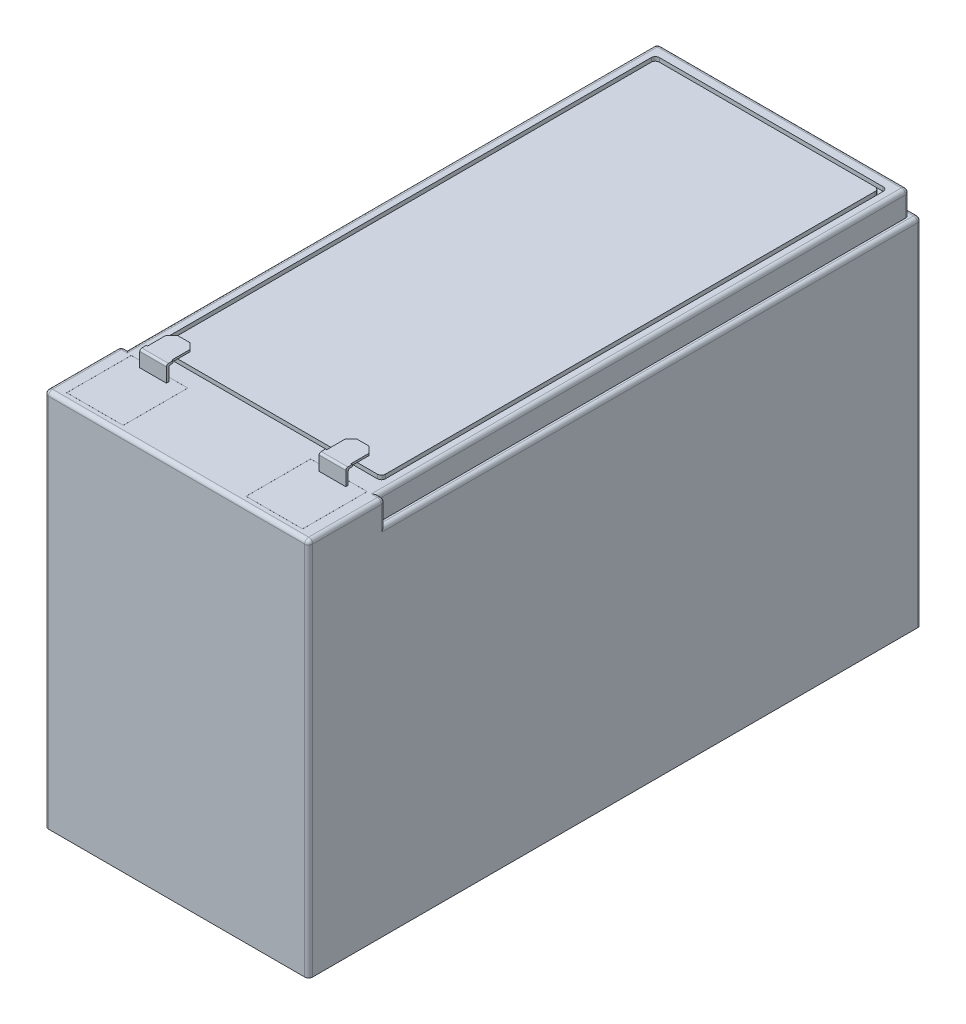
from build123d import *

# Parameters (mm, degrees)
CROQUIS1_W              = 65.4
CROQUIS1_H              = 151.7
SALIENTE_EXTRUIR1_DEPTH = 93.8
CORTAR_EXTRUIR1_DEPTH   = 6
REDONDEO1_R             = 1
CORTAR_EXTRUIR2_DEPTH   = 1
CROQUIS4_W              = 14
CROQUIS4_H              = 16
CROQUIS4_W_2            = 13.98
CROQUIS4_H_2            = 15.98
CORTAR_EXTRUIR3_DEPTH   = 1
CROQUIS5_W              = 6.6
CROQUIS5_H              = 0.6
SALIENTE_EXTRUIR2_DEPTH = 4
CROQUIS6_W              = 6.6
CROQUIS6_H              = 0.5
SALIENTE_EXTRUIR3_DEPTH = 1
CROQUIS7_W              = 6
CROQUIS7_H              = 0.5
SALIENTE_EXTRUIR4_DEPTH = 6
REDONDEO2_R             = 0.5
CHAFL_N1_SIZE           = 1.5


with BuildPart() as part:
    # Croquis1 → Saliente-Extruir1 (new body)
    with BuildSketch(Plane(origin=(0, 0, 0), x_dir=(1, 0, 0), z_dir=(0, 1, 0))):
        Rectangle(CROQUIS1_W, CROQUIS1_H)
    extrude(amount=SALIENTE_EXTRUIR1_DEPTH)

    # Croquis2 → Cortar-Extruir1 (cut)
    with BuildSketch(Plane(origin=(0, 93.8, 0), x_dir=(1, 0, 0), z_dir=(0, 1, 0))):
        Polygon((-32.7, -56.85), (-32.7, 75.85), (32.7, 75.85), (32.7, -56.85), (31.2, -56.85), (31.2, 74.35), (-31.2, 74.35), (-31.2, -56.85), align=None)
    extrude(amount=-CORTAR_EXTRUIR1_DEPTH, mode=Mode.SUBTRACT)

    # Redondeo1
    redondeo1_edges = [part.edges().sort_by_distance(p)[0] for p in [
        (0, 93.8, 75.85),
        (-32.7, 93.8, 66.35),
        (-32.7, 43.9, -75.85),
        (32.7, 43.9, -75.85),
        (-32.7, 87.8, -9.5),
        (-32.7, 90.8, 56.85),
        (0, 87.8, -75.85),
        (32.7, 87.8, -9.5),
        (32.7, 90.8, 56.85),
        (31.2, 90.8, -74.35),
        (-31.2, 90.8, -74.35),
        (-31.95, 93.8, 56.85),
        (-31.2, 93.8, -8.75),
        (0, 93.8, -74.35),
        (31.2, 93.8, -8.75),
        (31.95, 93.8, 56.85),
        (32.7, 93.8, 66.35),
        (32.7, 46.9, 75.85),
        (-32.7, 46.9, 75.85),
    ]]
    fillet(redondeo1_edges, radius=REDONDEO1_R)

    # Croquis3 → Cortar-Extruir2 (cut)
    with BuildSketch(Plane(origin=(0, 93.8, 0), x_dir=(1, 0, 0), z_dir=(0, 1, 0))):
        with BuildLine():
            Line((-27.7, -53.85), (27.7, -53.85))
            ThreePointArc((27.7, -53.85), (28.407106781, -53.557106781), (28.7, -52.85))
            Line((28.7, -52.85), (28.7, 70.35))
            ThreePointArc((28.7, 70.35), (28.407106781, 71.057106781), (27.7, 71.35))
            Line((27.7, 71.35), (-27.7, 71.35))
            ThreePointArc((-27.7, 71.35), (-28.407106781, 71.057106781), (-28.7, 70.35))
            Line((-28.7, 70.35), (-28.7, -52.85))
            ThreePointArc((-28.7, -52.85), (-28.407106781, -53.557106781), (-27.7, -53.85))
        make_face()
        with BuildLine():
            Line((-26.7, -52.85), (26.7, -52.85))
            ThreePointArc((26.7, -52.85), (27.407106781, -52.557106781), (27.7, -51.85))
            Line((27.7, -51.85), (27.7, 69.35))
            ThreePointArc((27.7, 69.35), (27.407106781, 70.057106781), (26.7, 70.35))
            Line((26.7, 70.35), (-26.7, 70.35))
            ThreePointArc((-26.7, 70.35), (-27.407106781, 70.057106781), (-27.7, 69.35))
            Line((-27.7, 69.35), (-27.7, -51.85))
            ThreePointArc((-27.7, -51.85), (-27.407106781, -52.557106781), (-26.7, -52.85))
        make_face(mode=Mode.SUBTRACT)
    extrude(amount=-CORTAR_EXTRUIR2_DEPTH, mode=Mode.SUBTRACT)

    # Croquis4 → Cortar-Extruir3 (cut)
    # profile 1 of 2: a face of its own
    with BuildSketch(Plane(origin=(0, 93.8, 0), x_dir=(1, 0, 0), z_dir=(0, 1, 0))):
        with Locations((-22.2, -65.85)):
            Rectangle(CROQUIS4_W, CROQUIS4_H)
        with Locations((-22.2, -65.85)):
            Rectangle(CROQUIS4_W_2, CROQUIS4_H_2, mode=Mode.SUBTRACT)
    # profile 2 of 2: a face of its own
    with BuildSketch(Plane(origin=(0, 93.8, 0), x_dir=(1, 0, 0), z_dir=(0, 1, 0))):
        with Locations((22.2, -65.85)):
            Rectangle(CROQUIS4_W, CROQUIS4_H)
        with Locations((22.2, -65.85)):
            Rectangle(CROQUIS4_W_2, CROQUIS4_H_2, mode=Mode.SUBTRACT)
    extrude(amount=-CORTAR_EXTRUIR3_DEPTH, mode=Mode.SUBTRACT)

    # Croquis5 → Saliente-Extruir2 (add)
    with BuildSketch(Plane(origin=(0, 93.8, 0), x_dir=(1, 0, 0), z_dir=(0, 1, 0))):
        with Locations((-22.2, -59.16)):
            Rectangle(CROQUIS5_W, CROQUIS5_H)
        with Locations((22.2, -59.16)):
            Rectangle(CROQUIS5_W, CROQUIS5_H)
    extrude(amount=SALIENTE_EXTRUIR2_DEPTH)

    # Croquis6 → Saliente-Extruir3 (add)
    with BuildSketch(Plane(origin=(0, 0, 58.86), x_dir=(-1, 0, 0), z_dir=(0, 0, -1))):
        with Locations((22.2, 97.55)):
            Rectangle(CROQUIS6_W, CROQUIS6_H)
        with Locations((-22.2, 97.55)):
            Rectangle(CROQUIS6_W, CROQUIS6_H)
    extrude(amount=SALIENTE_EXTRUIR3_DEPTH)

    # Croquis7 → Saliente-Extruir4 (add)
    with BuildSketch(Plane(origin=(0, 0, 57.86), x_dir=(-1, 0, 0), z_dir=(0, 0, -1))):
        with Locations((22.2, 97.55)):
            Rectangle(CROQUIS7_W, CROQUIS7_H)
        with Locations((-22.2, 97.55)):
            Rectangle(CROQUIS7_W, CROQUIS7_H)
    extrude(amount=SALIENTE_EXTRUIR4_DEPTH)

    # Redondeo2
    redondeo2_edges = [part.edges().sort_by_distance(p)[0] for p in [
        (-22.2, 97.8, 59.46),
        (22.2, 97.8, 59.46),
        (-22.2, 97.3, 58.86),
        (22.2, 97.3, 58.86),
    ]]
    fillet(redondeo2_edges, radius=REDONDEO2_R)

    # Chaflán1
    chafl_n1_edges = [part.edges().sort_by_distance(p)[0] for p in [
        (-25.2, 97.55, 51.86),
        (-19.2, 97.55, 51.86),
        (25.2, 97.55, 51.86),
        (19.2, 97.55, 51.86),
    ]]
    chamfer(chafl_n1_edges, length=CHAFL_N1_SIZE)


solid = part.part
